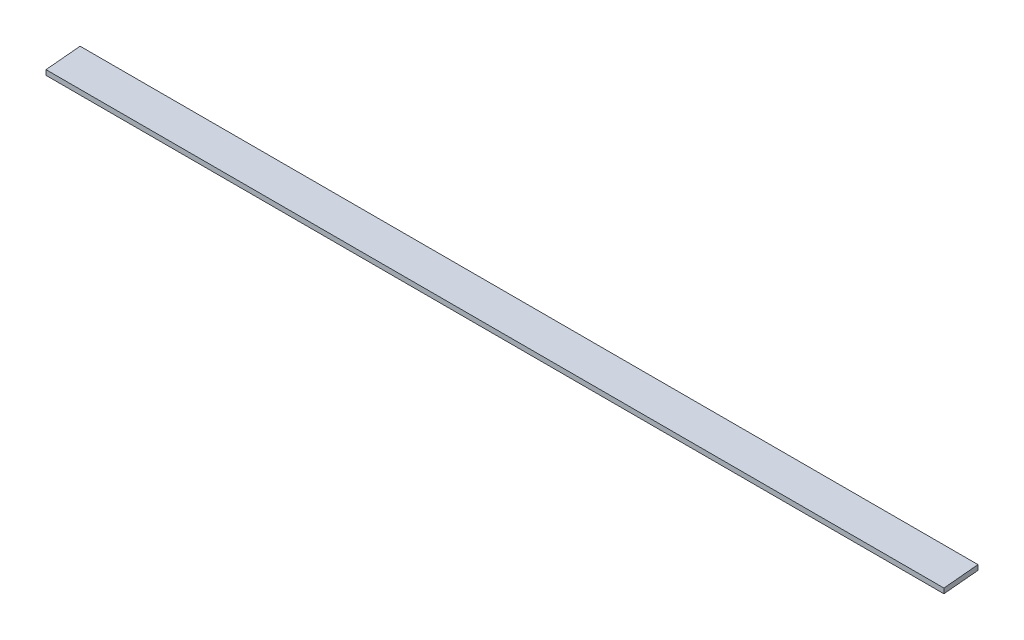
from build123d import *

# Parameters (mm, degrees)
SKETCH1_W           = 2286
SKETCH1_H           = 88.9
BOSS_EXTRUDE1_DEPTH = 11.90625
CUT_EXTRUDE1_DEPTH  = 1144.925942222


with BuildPart() as part:
    # Sketch1 → Boss-Extrude1 (new body)
    with BuildSketch(Plane(origin=(0, 0, 0), x_dir=(1, 0, 0), z_dir=(0, 1, 0))):
        Rectangle(SKETCH1_W, SKETCH1_H)
    extrude(amount=BOSS_EXTRUDE1_DEPTH)

    # Sketch4 → Cut-Extrude1 (cut, through all)
    with BuildSketch(Plane.XZ):
        Polygon((-1143, -44.45), (-1143, 44.45), (-1009.65, 44.45), (-1017.427742187, -44.45), align=None)
        Polygon((1120.141007813, -44.45), (1127.91875, 44.45), (1143, 44.45), (1143, -44.45), align=None)
    extrude(amount=-CUT_EXTRUDE1_DEPTH, mode=Mode.SUBTRACT)


solid = part.part
